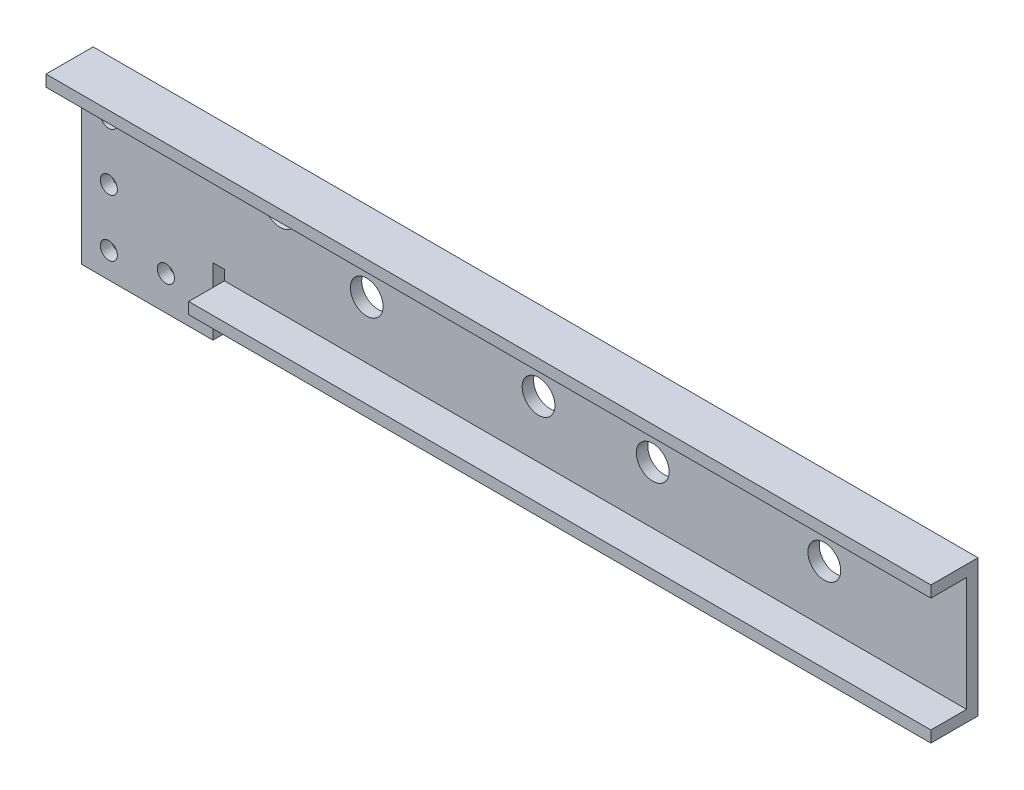
from build123d import *

# Parameters (mm, degrees)
SKETCH1_W           = 155
SKETCH1_H           = 32
BOSS_EXTRUDE1_DEPTH = 2
SKETCH2_W           = 155
SKETCH2_H           = 2
SKETCH2_W_2         = 130
BOSS_EXTRUDE2_DEPTH = 6.25
CUT_EXTRUDE1_DEPTH  = 6.25
SKETCH4_R           = 1.5
CUT_EXTRUDE2_DEPTH  = 6.25
SKETCH5_R           = 2.875
CUT_EXTRUDE3_DEPTH  = 6.25
SKETCH6_R           = 1.5
CUT_EXTRUDE4_DEPTH  = 6
CHAMFER1_SIZE       = 1.5


with BuildPart() as part:
    # Sketch1 → Boss-Extrude1 (new body)
    with BuildSketch(Plane.XY):
        with Locations((77.5, -16)):
            Rectangle(SKETCH1_W, SKETCH1_H)
    extrude(amount=BOSS_EXTRUDE1_DEPTH)

    # Sketch2 → Boss-Extrude2 (add)
    with BuildSketch(Plane.XY.offset(2)):
        with Locations((77.5, -1)):
            Rectangle(SKETCH2_W, SKETCH2_H)
        with Locations((90, -23)):
            Rectangle(SKETCH2_W_2, SKETCH2_H)
    extrude(amount=BOSS_EXTRUDE2_DEPTH)

    # Sketch3 → Cut-Extrude1 (cut)
    with BuildSketch(Plane.XY.offset(2)):
        Polygon((155, -32), (23, -32), (23, -24), (23, -20.25), (25, -20.25), (25, -24), (155, -24), align=None)
    extrude(amount=-CUT_EXTRUDE1_DEPTH, mode=Mode.SUBTRACT)

    # Sketch4 → Cut-Extrude2 (cut)
    with BuildSketch(Plane.XY.offset(2)):
        with Locations((4.75, -27.5)):
            Circle(SKETCH4_R)
        with Locations((4.75, -17.5)):
            Circle(SKETCH4_R)
        with Locations((4.75, -7.5)):
            Circle(SKETCH4_R)
    extrude(amount=-CUT_EXTRUDE2_DEPTH, mode=Mode.SUBTRACT)

    # Sketch5 → Cut-Extrude3 (cut)
    with BuildSketch(Plane.XY.offset(2)):
        with Locations((130.075, -12)):
            Circle(SKETCH5_R)
        with Locations((100.025, -12)):
            Circle(SKETCH5_R)
        with Locations((80.025, -12)):
            Circle(SKETCH5_R)
        with Locations((49.925, -12)):
            Circle(SKETCH5_R)
    extrude(amount=-CUT_EXTRUDE3_DEPTH, mode=Mode.SUBTRACT)

    # Sketch6 → Cut-Extrude4 (cut)
    with BuildSketch(Plane.XY.offset(2)):
        with Locations((14.75, -26)):
            Circle(SKETCH6_R)
        with Locations((14.75, -6)):
            Circle(SKETCH6_R)
        with Locations((34.75, -6)):
            Circle(SKETCH6_R)
    extrude(amount=-CUT_EXTRUDE4_DEPTH, mode=Mode.SUBTRACT)

    # Chamfer1
    chamfer1_edges = [part.edges().sort_by_distance(p)[0] for p in [
        (33.25, -6, 2),
    ]]
    chamfer(chamfer1_edges, length=CHAMFER1_SIZE)


solid = part.part
